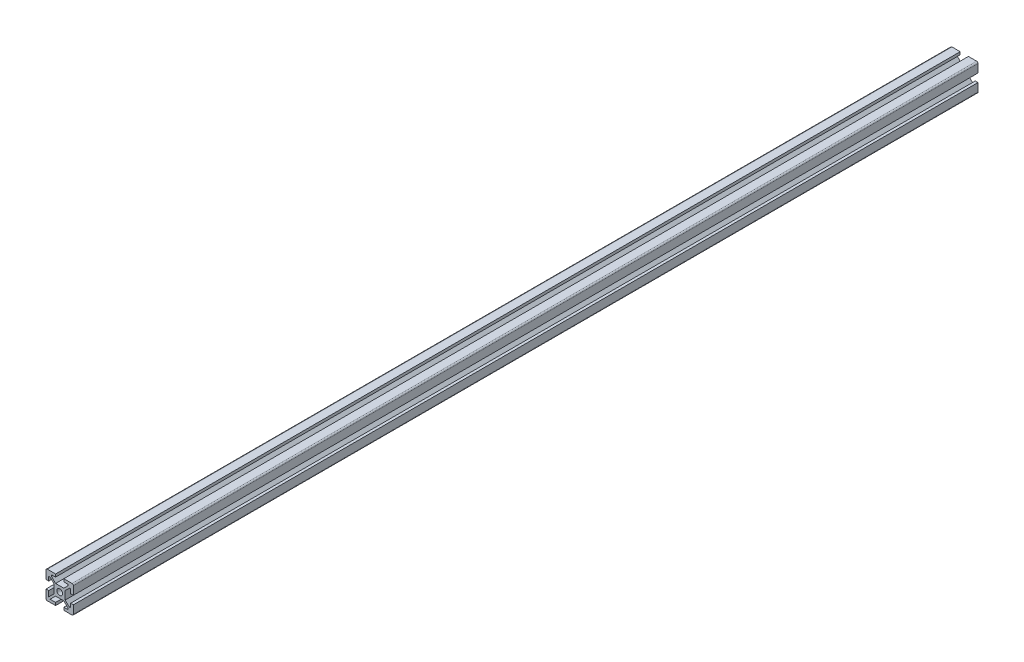
from build123d import *

# Parameters (mm, degrees)
SKETCH1_W           = 1
SKETCH1_H           = 1
SKETCH1_W_2         = 6
SKETCH1_H_2         = 6
SKETCH1_R           = 2.1
BOSS_EXTRUDE1_DEPTH = 660.4
FILLET1_R           = 1


with BuildPart() as part:
    # Sketch1 → Boss-Extrude1 (new body)
    # profile 1 of 35: a face of its own
    with BuildSketch(Plane.XY):
        Polygon((-6, 7), (-6, 8), (-7, 8), align=None)
    # profile 2 of 35: a face of its own
    with BuildSketch(Plane.XY):
        Polygon((-6, 7), (-7, 8), (-8, 8), (-8, 7), (-7, 6), (-6, 6), align=None)
    # profile 3 of 35: a face of its own
    with BuildSketch(Plane.XY):
        Polygon((-8, 7), (-8, 6), (-7, 6), align=None)
    # profile 4 of 35: a face of its own
    with BuildSketch(Plane.XY):
        Polygon((-3, 8), (-3, 10), (-10, 10), (-10, 3), (-8, 3), (-8, 6), (-8, 7), (-8, 8), (-7, 8), (-6, 8), align=None)
    # profile 5 of 35: a face of its own
    with BuildSketch(Plane.XY):
        Polygon((-6, 5), (-6, 6), (-7, 6), align=None)
    # profile 6 of 35: a face of its own
    with BuildSketch(Plane.XY):
        Polygon((-6, 6), (-5, 6), (-6, 7), align=None)
    # profile 7 of 35: a face of its own
    with BuildSketch(Plane.XY):
        Polygon((-3, 4), (-5, 6), (-6, 6), (-6, 5), (-4, 3), (-4, 4), align=None)
    # profile 8 of 35: a face of its own
    with BuildSketch(Plane.XY):
        with Locations((-3.5, 3.5)):
            Rectangle(SKETCH1_W, SKETCH1_H)
    # profile 9 of 35: a face of its own
    with BuildSketch(Plane.XY):
        with Locations((0, 3.5)):
            Rectangle(SKETCH1_W_2, SKETCH1_H)
    # profile 10 of 35: a face of its own
    with BuildSketch(Plane.XY):
        with Locations((-3.5, 0)):
            Rectangle(SKETCH1_W, SKETCH1_H_2)
    # profile 11 of 35: a face of its own
    with BuildSketch(Plane.XY):
        Rectangle(SKETCH1_W_2, SKETCH1_H_2)
        Circle(SKETCH1_R, mode=Mode.SUBTRACT)
    # profile 12 of 35: a face of its own
    with BuildSketch(Plane.XY):
        with Locations((3.5, 3.5)):
            Rectangle(SKETCH1_W, SKETCH1_H)
    # profile 13 of 35: a face of its own
    with BuildSketch(Plane.XY):
        Polygon((6, 6), (5, 6), (3, 4), (4, 4), (4, 3), (6, 5), align=None)
    # profile 14 of 35: a face of its own
    with BuildSketch(Plane.XY):
        Polygon((6, 7), (5, 6), (6, 6), align=None)
    # profile 15 of 35: a face of its own
    with BuildSketch(Plane.XY):
        Polygon((6, 6), (6, 5), (7, 6), align=None)
    # profile 16 of 35: a face of its own
    with BuildSketch(Plane.XY):
        Polygon((8, 8), (7, 8), (6, 7), (6, 6), (7, 6), (8, 7), align=None)
    # profile 17 of 35: a face of its own
    with BuildSketch(Plane.XY):
        Polygon((7, 8), (6, 8), (6, 7), align=None)
    # profile 18 of 35: a face of its own
    with BuildSketch(Plane.XY):
        Polygon((7, 6), (8, 6), (8, 7), align=None)
    # profile 19 of 35: a face of its own
    with BuildSketch(Plane.XY):
        Polygon((10, 3), (10, 10), (3, 10), (3, 8), (6, 8), (7, 8), (8, 8), (8, 7), (8, 6), (8, 3), align=None)
    # profile 20 of 35: a face of its own
    with BuildSketch(Plane.XY):
        with Locations((3.5, 0)):
            Rectangle(SKETCH1_W, SKETCH1_H_2)
    # profile 21 of 35: a face of its own
    with BuildSketch(Plane.XY):
        with Locations((3.5, -3.5)):
            Rectangle(SKETCH1_W, SKETCH1_H)
    # profile 22 of 35: a face of its own
    with BuildSketch(Plane.XY):
        Polygon((6, -6), (6, -5), (4, -3), (4, -4), (3, -4), (5, -6), align=None)
    # profile 23 of 35: a face of its own
    with BuildSketch(Plane.XY):
        Polygon((7, -6), (6, -5), (6, -6), align=None)
    # profile 24 of 35: a face of its own
    with BuildSketch(Plane.XY):
        Polygon((6, -7), (6, -6), (5, -6), align=None)
    # profile 25 of 35: a face of its own
    with BuildSketch(Plane.XY):
        Polygon((8, -8), (8, -7), (7, -6), (6, -6), (6, -7), (7, -8), align=None)
    # profile 26 of 35: a face of its own
    with BuildSketch(Plane.XY):
        Polygon((6, -7), (6, -8), (7, -8), align=None)
    # profile 27 of 35: a face of its own
    with BuildSketch(Plane.XY):
        Polygon((8, -7), (8, -6), (7, -6), align=None)
    # profile 28 of 35: a face of its own
    with BuildSketch(Plane.XY):
        Polygon((10, -10), (10, -3), (8, -3), (8, -6), (8, -7), (8, -8), (7, -8), (6, -8), (3, -8), (3, -10), align=None)
    # profile 29 of 35: a face of its own
    with BuildSketch(Plane.XY):
        with Locations((0, -3.5)):
            Rectangle(SKETCH1_W_2, SKETCH1_H)
    # profile 30 of 35: a face of its own
    with BuildSketch(Plane.XY):
        with Locations((-3.5, -3.5)):
            Rectangle(SKETCH1_W, SKETCH1_H)
    # profile 31 of 35: a face of its own
    with BuildSketch(Plane.XY):
        Polygon((-4, -3), (-6, -5), (-6, -6), (-5, -6), (-3, -4), (-4, -4), align=None)
    # profile 32 of 35: a face of its own
    with BuildSketch(Plane.XY):
        Polygon((-6, -7), (-5, -6), (-6, -6), align=None)
    # profile 33 of 35: a face of its own
    with BuildSketch(Plane.XY):
        Polygon((-6, -6), (-6, -5), (-7, -6), align=None)
    # profile 34 of 35: a face of its own
    with BuildSketch(Plane.XY):
        Polygon((-7, -6), (-8, -7), (-8, -8), (-7, -8), (-6, -7), (-6, -6), align=None)
    # profile 35 of 35: a face of its own
    with BuildSketch(Plane.XY):
        Polygon((-8, -3), (-10, -3), (-10, -10), (-3, -10), (-3, -8), (-6, -8), (-7, -8), (-8, -8), (-8, -7), (-8, -6), align=None)
    extrude(amount=BOSS_EXTRUDE1_DEPTH)

    # Fillet1
    fillet1_edges = [part.edges().sort_by_distance(p)[0] for p in [
        (-10, -10, 330.2),
        (-10, 10, 330.2),
        (10, 10, 330.2),
        (10, -10, 330.2),
    ]]
    fillet(fillet1_edges, radius=FILLET1_R)


solid = part.part
